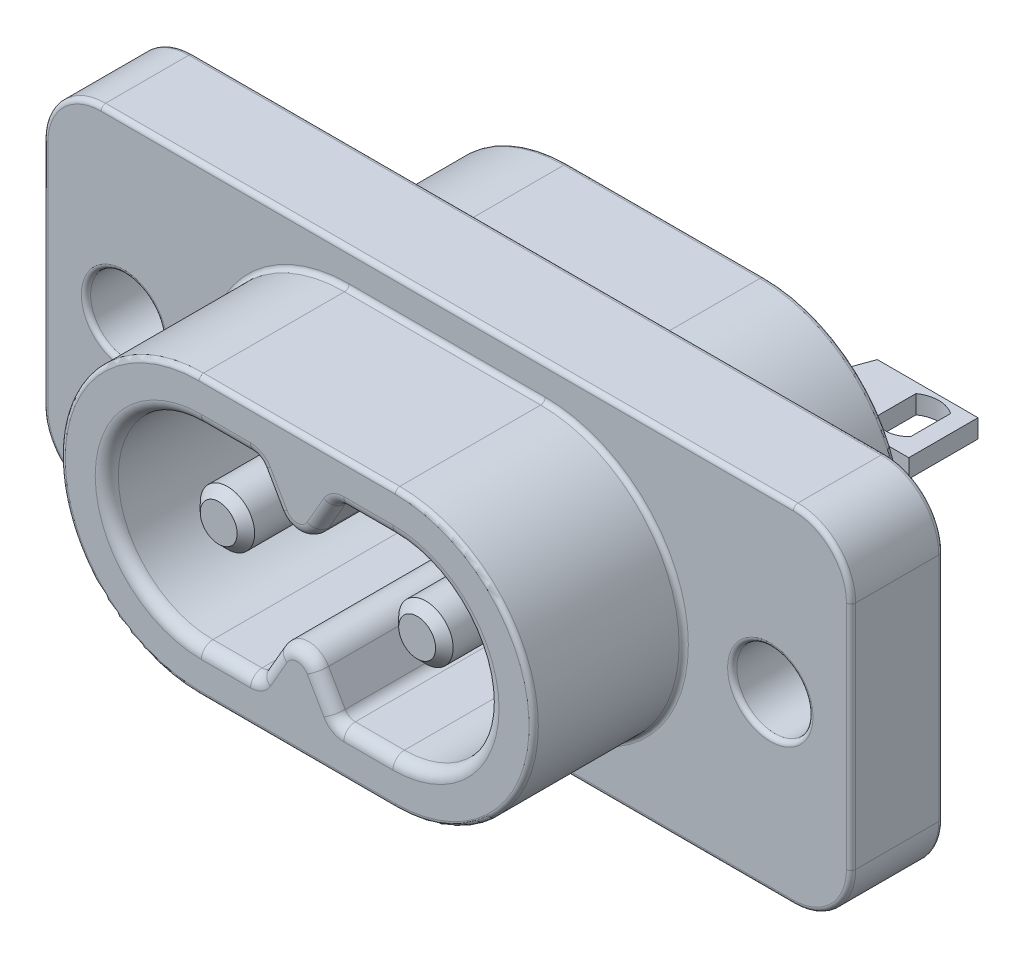
from build123d import *

# Parameters (mm, degrees)
SKICA1_W                     = 35
SKICA1_H                     = 5.2
P_IDAT_VYSUNUT_M1_DEPTH      = 9.5
P_IDAT_VYSUNUT_M2_DEPTH      = 0.8
SKICA3_W                     = 35
SKICA3_H                     = 9.5
P_IDAT_VYSUNUT_M3_DEPTH      = 5.332682252
ODEBRAT_VYSUNUT_M1_DEPTH     = 5.5
ODEBRAT_VYSUNUT_M2_DEPTH     = 5.5
P_IDAT_VYSUNUT_M4_DEPTH      = 2.167317748
SKICA9_W                     = 35
SKICA9_H                     = 4
P_IDAT_VYSUNUT_M6_DEPTH      = 1.5
SKICA10_W                    = 3
SKICA10_H                    = 1.5
P_IDAT_VYSUNUT_M7_DEPTH      = 2
SKICA11_W                    = 3
SKICA11_H                    = 1.5
P_IDAT_VYSUNUT_M8_DEPTH      = 2
ODEBRAT_VYSUNUT_M4_REACH     = 23.506
SKICA13_W                    = 8
SKICA13_H                    = 1.5
ODEBRAT_VYSUNUT_M5_REACH     = 28.968
ODEBRAT_VYSUNUT_M6_DEPTH     = 27.162950904
ODEBRAT_VYSUNUT_M7_DEPTH     = 24.89853552
P_IDAT_VYSUNUT_M9_DEPTH      = 6.5
ODEBRAT_VYSUNUT_M9_DEPTH     = 10
SKICA20_W                    = 1.18
SKICA20_H                    = 9.1
SKICA21_W                    = 1.18
SKICA21_H                    = 9.1
F_3_3_3_3_PR_M_R_D_RY1_D     = 3.3
F_3_3_3_3_PR_M_R_D_RY1_DEPTH = 14.000025
ZAOBLIT1_R                   = 2.5
ZKOSEN_1_SIZE                = 0.38
ZAOBLIT3_R                   = 0.5
LINPOLE1_COUNT               = 2
LINPOLE1_PITCH               = 15
ZAOBLIT4_R                   = 0.2
ZAOBLIT5_R                   = 0.2
ZAOBLIT6_R                   = 0.2


with BuildPart() as part:
    # Skica1 → Přidat vysunutím1 (new body)
    with BuildSketch(Plane(origin=(0, 0, -9.5), x_dir=(-1, 0, 0), z_dir=(0, 0, -1))):
        with Locations((0, 3.4)):
            Rectangle(SKICA1_W, SKICA1_H)
    extrude(amount=-P_IDAT_VYSUNUT_M1_DEPTH)

    # Skica2 → Přidat vysunutím2 (add)
    with BuildSketch(Plane(origin=(0, 0.8, 0), x_dir=(-1, 0, 0), z_dir=(0, -1, 0))):
        Polygon((-9, 11), (-9, 14), (-4.637866054, 14), (-3, 9.5), (3, 9.5), (4.637866054, 14), (9, 14), (9, 11), (5.940355339, 11), (5.394399988, 9.5), (17.5, 9.5), (17.5, 0), (-17.5, 0), (-17.5, 9.5), (-5.394399988, 9.5), (-5.940355339, 11), align=None)
    extrude(amount=P_IDAT_VYSUNUT_M2_DEPTH)

    # Skica3 → Přidat vysunutím3 (add)
    with BuildSketch(Plane.XZ):
        with Locations((0, -4.75)):
            Rectangle(SKICA3_W, SKICA3_H)
    extrude(amount=P_IDAT_VYSUNUT_M3_DEPTH)

    # Skica4 → Odebrat vysunutím1 (cut)
    with BuildSketch(Plane(origin=(0, 0, -9.5), x_dir=(-1, 0, 0), z_dir=(0, 0, -1))):
        with BuildLine():
            Line((7, -5.332682252), (17.5, -5.332682252))
            Line((17.5, -5.332682252), (17.5, 6))
            Line((17.5, 6), (4.25, 6))
            ThreePointArc((4.25, 6), (10.080784403, 1.41490397), (7, -5.332682252))
        make_face()
    extrude(amount=-ODEBRAT_VYSUNUT_M1_DEPTH, mode=Mode.SUBTRACT)

    # Skica5 → Odebrat vysunutím2 (cut)
    with BuildSketch(Plane(origin=(0, 0, -9.5), x_dir=(-1, 0, 0), z_dir=(0, 0, -1))):
        with BuildLine():
            Line((-17.5, 6), (-17.5, -5.332682252))
            Line((-17.5, -5.332682252), (-7, -5.332682252))
            ThreePointArc((-7, -5.332682252), (-10.080784403, 1.41490397), (-4.25, 6))
            Line((-4.25, 6), (-17.5, 6))
        make_face()
    extrude(amount=-ODEBRAT_VYSUNUT_M2_DEPTH, mode=Mode.SUBTRACT)

    # Skica7 → Přidat vysunutím4 (add)
    with BuildSketch(Plane.XZ.offset(5.332682252)):
        Polygon((-7, -9.5), (-7, -4), (-17.5, -4), (-17.5, 0), (17.5, 0), (17.5, -4), (7, -4), (7, -9.5), align=None)
    extrude(amount=P_IDAT_VYSUNUT_M4_DEPTH)

    # Skica9 → Přidat vysunutím6 (add)
    with BuildSketch(Plane(origin=(0, 6, 0), x_dir=(1, 0, 0), z_dir=(0, 1, 0))):
        with Locations((0, 2)):
            Rectangle(SKICA9_W, SKICA9_H)
    extrude(amount=P_IDAT_VYSUNUT_M6_DEPTH)

    # Skica10 → Přidat vysunutím7 (add)
    with BuildSketch(Plane(origin=(0, 0, -9.5), x_dir=(-1, 0, 0), z_dir=(0, 0, -1))):
        with Locations((5.5, -6.75)):
            Rectangle(SKICA10_W, SKICA10_H)
    extrude(amount=P_IDAT_VYSUNUT_M7_DEPTH)

    # Skica11 → Přidat vysunutím8 (add)
    with BuildSketch(Plane(origin=(0, 0, -9.5), x_dir=(-1, 0, 0), z_dir=(0, 0, -1))):
        with Locations((-5.5, -6.75)):
            Rectangle(SKICA11_W, SKICA11_H)
    extrude(amount=P_IDAT_VYSUNUT_M8_DEPTH)

    # Skica13 → Odebrat vysunutím4 (cut, up to next)
    with BuildSketch(Plane.XY.offset(-4), mode=Mode.PRIVATE) as odebrat_vysunut_m4_sk1:
        with Locations((0, -6.75)):
            Rectangle(SKICA13_W, SKICA13_H)
    odebrat_vysunut_m4_tool1 = extrude(odebrat_vysunut_m4_sk1.sketch, amount=-ODEBRAT_VYSUNUT_M4_REACH, mode=Mode.PRIVATE) & part.part
    add(odebrat_vysunut_m4_tool1.solids().sort_by_distance((0, -6.75, -4))[0], mode=Mode.SUBTRACT)

    # Skica14 → Odebrat vysunutím5 (cut, up to next)
    with BuildSketch(Plane.XZ.offset(7.5), mode=Mode.PRIVATE) as odebrat_vysunut_m5_sk1:
        with BuildLine():
            Line((-5, -11.5), (-5, -10.5))
            ThreePointArc((-5, -10.5), (-5.5, -10), (-6, -10.5))
            Line((-6, -10.5), (-6, -11.5))
            Line((-6, -11.5), (-5, -11.5))
        make_face()
    odebrat_vysunut_m5_tool1 = extrude(odebrat_vysunut_m5_sk1.sketch, amount=-ODEBRAT_VYSUNUT_M5_REACH, mode=Mode.PRIVATE) & part.part
    add(odebrat_vysunut_m5_tool1.solids().sort_by_distance((-5.5, -7.5, -10.799179))[0], mode=Mode.SUBTRACT)

    # Skica15 → Odebrat vysunutím6 (cut, through all)
    with BuildSketch(Plane(origin=(0, -6, 0), x_dir=(-1, 0, 0), z_dir=(0, 1, 0))):
        with BuildLine():
            Line((-6, -11.5), (-5, -11.5))
            Line((-5, -11.5), (-5, -10.5))
            ThreePointArc((-5, -10.5), (-5.5, -10), (-6, -10.5))
            Line((-6, -10.5), (-6, -11.5))
        make_face()
    extrude(amount=-ODEBRAT_VYSUNUT_M6_DEPTH, mode=Mode.SUBTRACT)

    # Skica16 → Odebrat vysunutím7 (cut, through all)
    with BuildSketch(Plane(origin=(0, 0.8, 0), x_dir=(-1, 0, 0), z_dir=(0, 1, 0))):
        with BuildLine():
            Line((-8.25, -11.838562172), (-8.25, -13.561838029))
            ThreePointArc((-8.25, -13.561838029), (-7.5, -13.8), (-6.75, -13.561838029))
            Line((-6.75, -13.561838029), (-6.75, -11.838562172))
            ThreePointArc((-6.75, -11.838562172), (-7.5, -11.5), (-8.25, -11.838562172))
        make_face()
    odebrat_vysunut_m7 = extrude(amount=-ODEBRAT_VYSUNUT_M7_DEPTH, mode=Mode.SUBTRACT)

    # Skica18 → Přidat vysunutím9 (add)
    with BuildSketch(Plane.XY):
        with BuildLine():
            Line((-4.25, 6), (4.25, 6))
            ThreePointArc((4.25, 6), (10.25, 0), (4.25, -6))
            Line((4.25, -6), (-4.25, -6))
            ThreePointArc((-4.25, -6), (-10.25, 0), (-4.25, 6))
        make_face()
    extrude(amount=P_IDAT_VYSUNUT_M9_DEPTH)

    # Skica19 → Odebrat vysunutím9 (cut)
    with BuildSketch(Plane.XY.offset(6.5)):
        with BuildLine():
            Line((0.866025404, -2.6), (1.732050808, -4.1))
            Line((1.732050808, -4.1), (4.15, -4.1))
            ThreePointArc((4.15, -4.1), (8.25, 0), (4.15, 4.1))
            Line((4.15, 4.1), (1.732050808, 4.1))
            Line((1.732050808, 4.1), (0.866025404, 2.6))
            ThreePointArc((0.866025404, 2.6), (0, 2.1), (-0.866025404, 2.6))
            Line((-0.866025404, 2.6), (-1.732050808, 4.1))
            Line((-1.732050808, 4.1), (-4.15, 4.1))
            ThreePointArc((-4.15, 4.1), (-8.25, 0), (-4.15, -4.1))
            Line((-4.15, -4.1), (-1.732050808, -4.1))
            Line((-1.732050808, -4.1), (-0.866025404, -2.6))
            ThreePointArc((-0.866025404, -2.6), (0, -2.1), (0.866025404, -2.6))
        make_face()
    extrude(amount=-ODEBRAT_VYSUNUT_M9_DEPTH, mode=Mode.SUBTRACT)

    # Skica20 → Rotovat1 (revolve)
    with BuildSketch(Plane(origin=(0, 0, 0), x_dir=(1, 0, 0), z_dir=(0, 1, 0))):
        with Locations((-3.71, -1.05)):
            Rectangle(SKICA20_W, SKICA20_H)
    revolve(axis=Axis((-4.3, 0, -3.5), (0, 0, 1)))

    # Skica21 → Rotovat2 (revolve)
    with BuildSketch(Plane(origin=(0, 0, 0), x_dir=(1, 0, 0), z_dir=(0, 1, 0))):
        with Locations((4.89, -1.05)):
            Rectangle(SKICA21_W, SKICA21_H)
    revolve(axis=Axis((4.3, 0, -3.5), (0, 0, 1)))

    # Ø3.3 (3.3) průměr díry1
    with Locations(Plane.XY):
        with Locations((-14, 0), (14, 0)):
            Hole(F_3_3_3_3_PR_M_R_D_RY1_D / 2, depth=F_3_3_3_3_PR_M_R_D_RY1_DEPTH)

    # Zaoblit1
    zaoblit1_edges = [part.edges().sort_by_distance(p)[0] for p in [
        (17.5, -7.5, -2),
        (-17.5, -7.5, -2),
        (-17.5, 7.5, -2),
        (17.5, 7.5, -2),
    ]]
    fillet(zaoblit1_edges, radius=ZAOBLIT1_R)

    # Zkosení1
    zkosen_1_edges = [part.edges().sort_by_distance(p)[0] for p in [
        (-5.48, 0, 5.6),
        (3.12, 0, 5.6),
    ]]
    chamfer(zkosen_1_edges, length=ZKOSEN_1_SIZE)

    # Zaoblit3
    zaoblit3_edges = [part.edges().sort_by_distance(p)[0] for p in [
        (-1.732050808, -4.1, 1.5),
        (-1.732050808, 4.1, 1.5),
        (1.732050808, 4.1, 1.5),
        (1.732050808, -4.1, 1.5),
        (0, -2.1, 6.5),
        (1.299038106, -3.35, 6.5),
        (2.941025404, -4.1, 6.5),
        (8.25, 0, 6.5),
        (2.941025404, 4.1, 6.5),
        (1.299038106, 3.35, 6.5),
        (0, 2.1, 6.5),
        (-1.299038106, 3.35, 6.5),
        (-2.941025404, 4.1, 6.5),
        (-8.25, 0, 6.5),
        (-2.941025404, -4.1, 6.5),
        (-1.299038106, -3.35, 6.5),
    ]]
    fillet(zaoblit3_edges, radius=ZAOBLIT3_R)

    # LinPole1: Odebrat vysunutím7 ×2
    with Locations(*[(-i * LINPOLE1_PITCH, 0, 0) for i in range(1, LINPOLE1_COUNT)]):
        add(odebrat_vysunut_m7, mode=Mode.SUBTRACT)

    # Zaoblit4
    zaoblit4_edges = [part.edges().sort_by_distance(p)[0] for p in [
        (-10.25, 0, 0),
        (0, -6, 0),
        (10.25, 0, 0),
        (0, 6, 0),
        (15.65, 0, 0),
        (-12.35, 0, 0),
        (0, -7.5, 0),
        (-17.5, 0, 0),
        (17.5, 0, 0),
        (0, 7.5, 0),
        (16.767766953, -6.767766953, 0),
        (-16.767766953, 6.767766953, 0),
        (16.767766953, 6.767766953, 0),
        (-16.767766953, -6.767766953, 0),
    ]]
    fillet(zaoblit4_edges, radius=ZAOBLIT4_R)

    # Zaoblit5
    zaoblit5_edges = [part.edges().sort_by_distance(p)[0] for p in [
        (-10.25, 0, 6.5),
        (0, -6, 6.5),
        (10.25, 0, 6.5),
        (0, 6, 6.5),
    ]]
    fillet(zaoblit5_edges, radius=ZAOBLIT5_R)

    # Zaoblit6
    zaoblit6_edges = [part.edges().sort_by_distance(p)[0] for p in [
        (10.080784403, 1.41490397, -9.5),
        (7, -6.416341126, -4),
        (-7, -6.416341126, -4),
        (7, -7.5, -7.75),
        (11, -7.5, -4),
        (-7, -7.5, -7.75),
        (0, 6, -4),
        (-4, -7.5, -7.75),
        (4, -7.5, -7.75),
        (0, -6, -4),
        (-4, -6.75, -4),
        (0, -7.5, -4),
        (4, -6.75, -4),
        (0, -6, -9.5),
        (15.65, 0, -4),
        (-12.35, 0, -4),
        (-11, -7.5, -4),
        (-17.5, 0, -4),
        (0, 7.5, -4),
        (17.5, 0, -4),
        (16.767766953, -6.767766953, -4),
        (-16.767766953, 6.767766953, -4),
        (16.767766953, 6.767766953, -4),
        (-16.767766953, -6.767766953, -4),
        (0, 6, -9.5),
        (-10.080784403, 1.41490397, -4),
        (-10.080784403, 1.41490397, -9.5),
        (10.080784403, 1.41490397, -4),
    ]]
    fillet(zaoblit6_edges, radius=ZAOBLIT6_R)


solid = part.part
